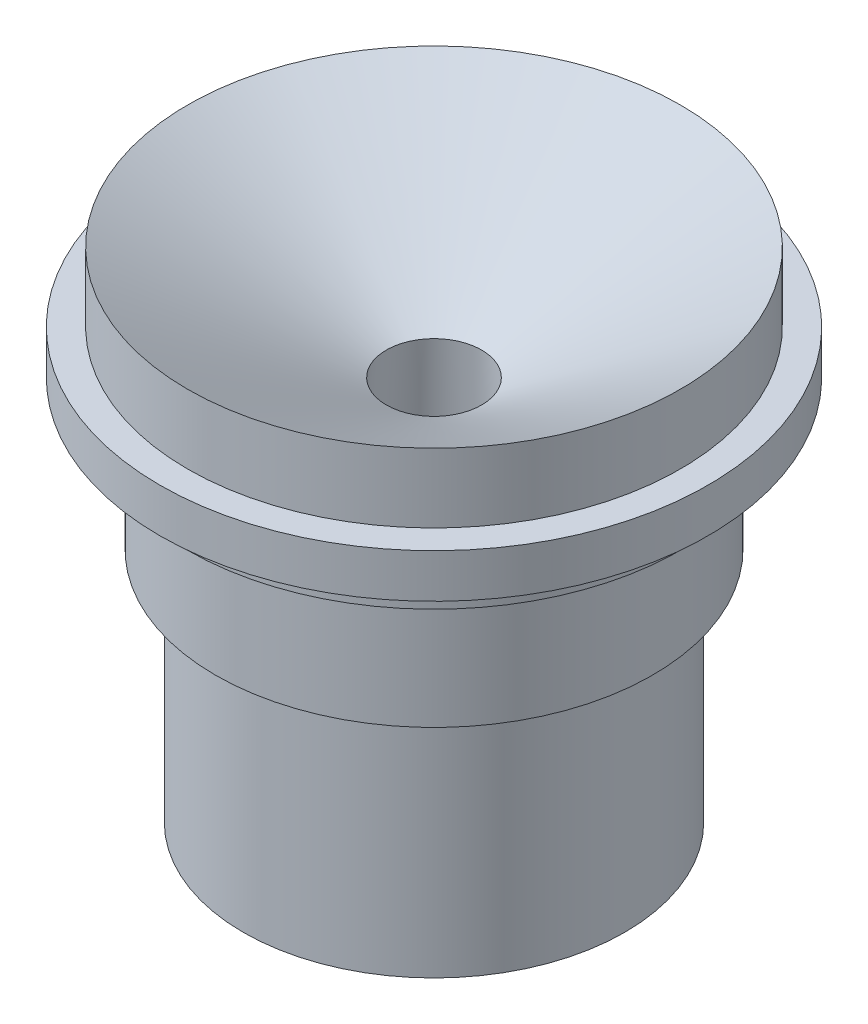
from build123d import *


with BuildPart() as part:
    # Sketch2 → Revolve2 (revolve)
    with BuildSketch(Plane.XY, mode=Mode.PRIVATE) as revolve2_sk:
        Polygon((13.26842947, 0), (34.29, 0), (34.29, 42.545), (39.29, 42.545), (39.29, 64.486486594), (44.29, 64.486486594), (44.29, 69.254596693), (49.29, 69.254596693), (49.29, 77.137624246), (44.29, 77.137624246), (44.29, 89.558741212), (8.566253152, 69.254596693), align=None)
    revolve(revolve2_sk.sketch.rotate(Axis((0, 89.558741212, 0), (0, -1, 0)), 90), axis=Axis((0, 89.558741212, 0), (0, -1, 0)))


solid = part.part
